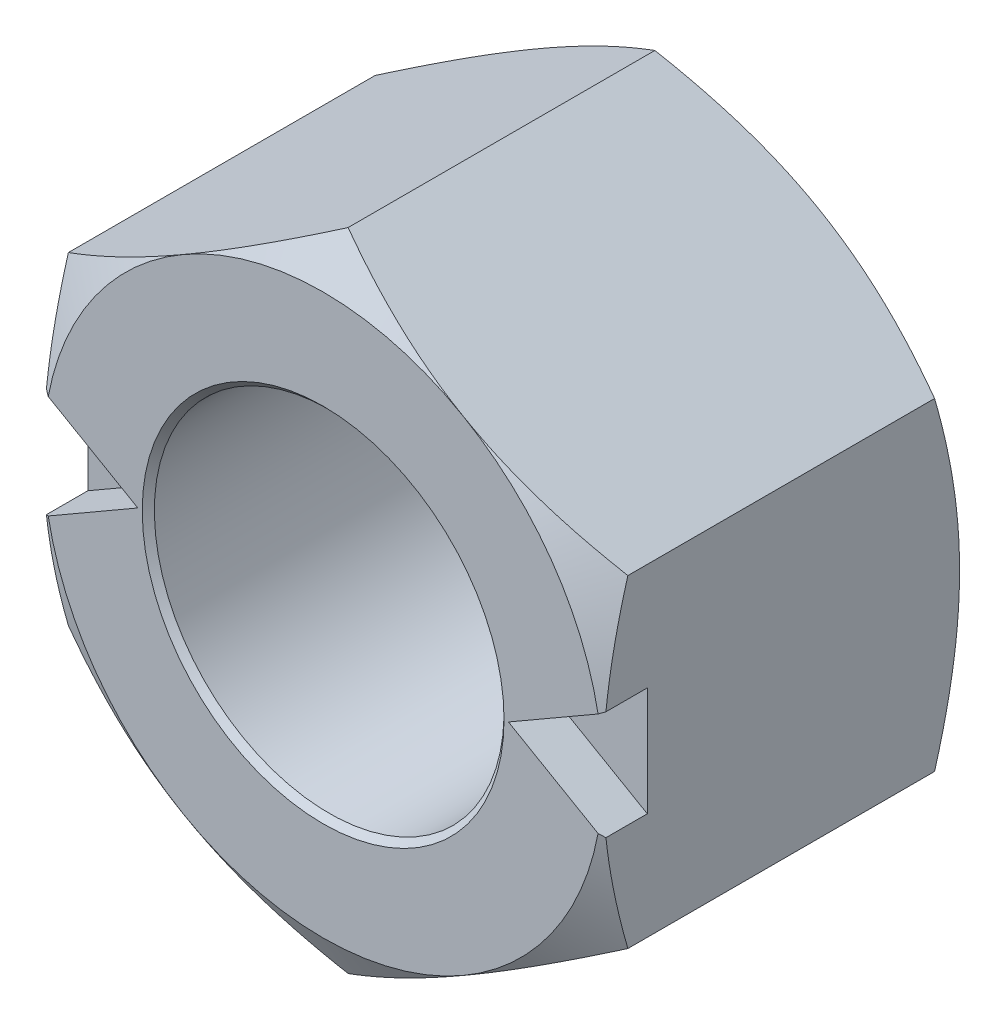
from build123d import *

# Parameters (mm, degrees)
BOSS_EXTRUDE1_DEPTH = 2.55
SKETCH5_OUTSIDE_W   = 43.682
SKETCH5_OUTSIDE_H   = 44.92
SKETCH5_OUTSIDE_R   = 4
CUT_EXTRUDE1_DEPTH  = 8.958852514
CUT_EXTRUDE1_DRAFT  = -60
SKETCH6_OUTSIDE_W   = 43.682
SKETCH6_OUTSIDE_H   = 44.92
SKETCH6_OUTSIDE_R   = 4
CUT_EXTRUDE2_DEPTH  = 8.958852514
CUT_EXTRUDE2_DRAFT  = -60
CUT_EXTRUDE3_DEPTH  = 0.635


with BuildPart() as part:
    # Sketch4 → Boss-Extrude1 (new, symmetric)
    with BuildSketch(Plane.XY):
        Polygon((-4, 2.309401077), (-4, -2.309401077), (0, -4.618802154), (4, -2.309401077), (4, 2.309401077), (0, 4.618802154), align=None)
    extrude(amount=BOSS_EXTRUDE1_DEPTH, both=True)


with BuildPart() as cut_extrude1_tool:
    # Sketch5 outside → Cut-Extrude1 (with draft: the straight prism first)
    with BuildSketch(Plane.XY.offset(2.55)):
        Rectangle(SKETCH5_OUTSIDE_W, SKETCH5_OUTSIDE_H)
        Circle(SKETCH5_OUTSIDE_R, mode=Mode.SUBTRACT)
    extrude(amount=-CUT_EXTRUDE1_DEPTH)
    # Cut-Extrude1: the draft: its side faces are tilted about the plane it starts from
    cut_extrude1_sides = [cut_extrude1_tool.faces().sort_by_distance(p)[0] for p in [
        (0, -22.46, -1.929426257),
        (21.841, 0, -1.929426257),
        (0, 22.46, -1.929426257),
        (-21.841, 0, -1.929426257),
        (-4, 0, -1.929426257),
    ]]
    draft(cut_extrude1_sides, Plane.XY.offset(2.55), CUT_EXTRUDE1_DRAFT)


with BuildPart() as part_1:
    add(part.part)

    # Cut-Extrude1: cut by cut_extrude1_tool
    add(cut_extrude1_tool.part, mode=Mode.SUBTRACT)


with BuildPart() as cut_extrude2_tool:
    # Sketch6 outside → Cut-Extrude2 (with draft: the straight prism first)
    with BuildSketch(Plane(origin=(0, 0, -2.55), x_dir=(-1, 0, 0), z_dir=(0, 0, -1))):
        Rectangle(SKETCH6_OUTSIDE_W, SKETCH6_OUTSIDE_H)
        Circle(SKETCH6_OUTSIDE_R, mode=Mode.SUBTRACT)
    extrude(amount=-CUT_EXTRUDE2_DEPTH)
    # Cut-Extrude2: the draft: its side faces are tilted about the plane it starts from
    cut_extrude2_sides = [cut_extrude2_tool.faces().sort_by_distance(p)[0] for p in [
        (0, -22.46, 1.929426257),
        (-21.841, 0, 1.929426257),
        (0, 22.46, 1.929426257),
        (21.841, 0, 1.929426257),
        (4, 0, 1.929426257),
    ]]
    draft(cut_extrude2_sides, Plane(origin=(0, 0, -2.55), x_dir=(-1, 0, 0), z_dir=(0, 0, -1)), CUT_EXTRUDE2_DRAFT)


with BuildPart() as part_2:
    add(part_1.part)

    # Cut-Extrude2: cut by cut_extrude2_tool
    add(cut_extrude2_tool.part, mode=Mode.SUBTRACT)

    # Sketch7 → Cut-Revolve1 (revolve, cut)
    with BuildSketch(Plane(origin=(0, 0, 0), x_dir=(0, 0, -1), z_dir=(1, 0, 0))):
        Polygon((2.55, 0), (-2.55, 0), (-2.55, 2.58660254), (-2.46339746, 2.5), (2.46339746, 2.5), (2.55, 2.58660254), align=None)
    revolve(axis=Axis((0, 0, -2.55), (0, 0, 1)), mode=Mode.SUBTRACT)

    # Sketch8 → Cut-Extrude3 (cut)
    with BuildSketch(Plane.XY.offset(2.55)):
        Polygon((-2.65010254, 0), (-4, -0.779363662), (-4, 0.779363662), align=None)
        Polygon((4, -0.779363662), (4, 0.779363662), (2.65010254, 0), align=None)
    extrude(amount=-CUT_EXTRUDE3_DEPTH, mode=Mode.SUBTRACT)


solid = part_2.part
